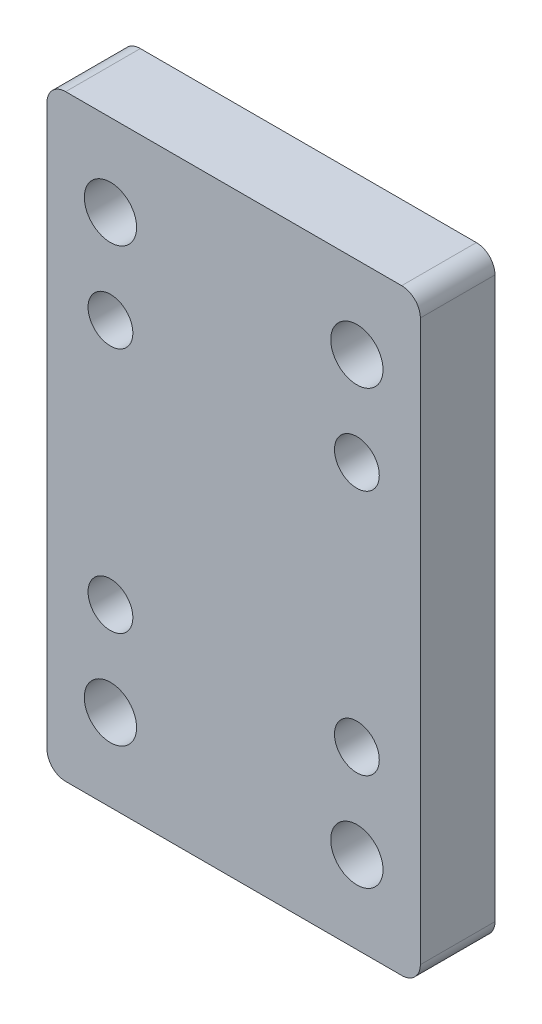
from build123d import *

# Parameters (mm, degrees)
SKETCH_2_W                 = 50
SKETCH_2_H                 = 80
EXTRUDE_1_DEPTH            = 10
SKETCH_3_R                 = 3.5
SKETCH_3_R_2               = 3
CUT_EXTRUDE_1_DEPTH        = 49.218253805
MIRROR_2_COPY_1_SKETCH_R   = 3.5
MIRROR_2_COPY_1_SKETCH_R_2 = 3
MIRROR_2_COPY_1_DEPTH      = 49.218253805
FILLET_1_R                 = 2.5


with BuildPart() as part:
    # 草图2 → 凸台-拉伸1 (new body)
    with BuildSketch(Plane.XY):
        Rectangle(SKETCH_2_W, SKETCH_2_H)
    extrude(amount=EXTRUDE_1_DEPTH)

    # 草图3 → 切除-拉伸1 (cut, through all)
    with BuildSketch(Plane(origin=(0, 0, 0), x_dir=(-1, 0, 0), z_dir=(0, 0, -1))):
        with Locations((16.5, 29)):
            Circle(SKETCH_3_R)
        with Locations((16.5, 16.5)):
            Circle(SKETCH_3_R_2)
    cut_extrude_1 = extrude(amount=-CUT_EXTRUDE_1_DEPTH, mode=Mode.SUBTRACT)

    # 镜向1: 切除-拉伸1 across plane
    add(cut_extrude_1.mirror(Plane(origin=(0, 0, 0), x_dir=(0, 0, 1), z_dir=(1, 0, 0))), mode=Mode.SUBTRACT)

    # 镜向2: 切除-拉伸1 across plane
    add(cut_extrude_1.mirror(Plane.ZX), mode=Mode.SUBTRACT)

    # 镜向2 copy 1 sketch → 镜向2 copy 1 (cut, through all)
    with BuildSketch(Plane(origin=(0, 0, 0), x_dir=(1, 0, 0), z_dir=(0, 0, -1))):
        with Locations((16.5, 29)):
            Circle(MIRROR_2_COPY_1_SKETCH_R)
        with Locations((16.5, 16.5)):
            Circle(MIRROR_2_COPY_1_SKETCH_R_2)
    extrude(amount=-MIRROR_2_COPY_1_DEPTH, mode=Mode.SUBTRACT)

    # 圆角1
    fillet_1_edges = [part.edges().sort_by_distance(p)[0] for p in [
        (-25, 40, 5),
        (25, 40, 5),
        (25, -40, 5),
        (-25, -40, 5),
    ]]
    fillet(fillet_1_edges, radius=FILLET_1_R)


solid = part.part
